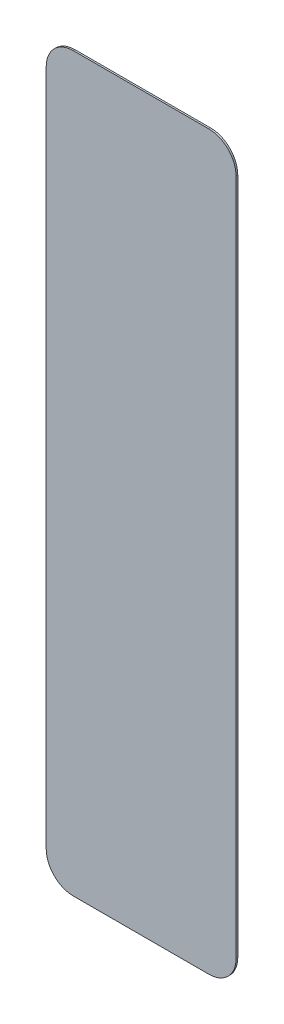
from build123d import *

# Parameters (mm, degrees)
BOSS_EXTRUDE1_DEPTH = 0.127


with BuildPart() as part:
    # Sketch1 → Boss-Extrude1 (new body)
    with BuildSketch(Plane.XY):
        with BuildLine():
            Line((0, -2), (0, -52))
            ThreePointArc((0, -52), (0.585786438, -53.414213562), (2, -54))
            Line((2, -54), (12, -54))
            ThreePointArc((12, -54), (13.414213562, -53.414213562), (14, -52))
            Line((14, -52), (14, -2))
            ThreePointArc((14, -2), (13.414213562, -0.585786438), (12, 0))
            Line((12, 0), (2, 0))
            ThreePointArc((2, 0), (0.585786438, -0.585786438), (0, -2))
        make_face()
    extrude(amount=-BOSS_EXTRUDE1_DEPTH)


solid = part.part
